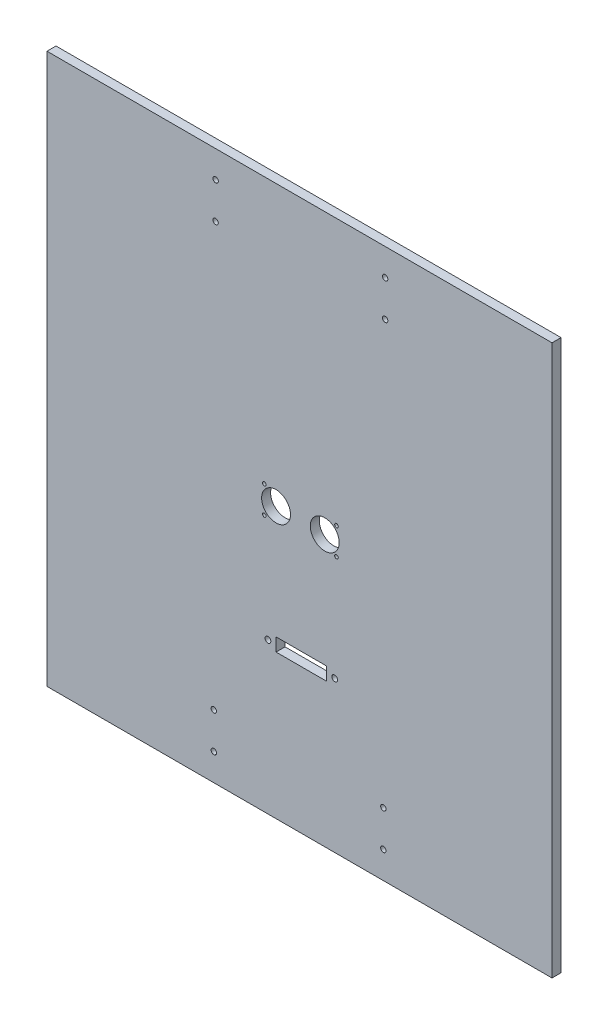
from build123d import *

# Parameters (mm, degrees)
ESQUISSE1_W             = 280
ESQUISSE1_H             = 305
BOSS_EXTRU_1_DEPTH      = 5
ESQUISSE2_R             = 1.5
ENL_V_MAT_EXTRU_1_DEPTH = 415.065212255
ESQUISSE3_R             = 1.5
ENL_V_MAT_EXTRU_2_DEPTH = 415.065212255
ESQUISSE4_R             = 1.6
ESQUISSE4_W             = 28
ESQUISSE4_H             = 7.3
ENL_V_MAT_EXTRU_3_DEPTH = 415.065212255
ESQUISSE5_R             = 8
ESQUISSE5_R_2           = 1
ENL_V_MAT_EXTRU_4_DEPTH = 415.065212255


with BuildPart() as part:
    # Esquisse1 → Boss.-Extru.1 (new body)
    with BuildSketch(Plane.XY):
        with Locations((140, 152.5)):
            Rectangle(ESQUISSE1_W, ESQUISSE1_H)
    extrude(amount=BOSS_EXTRU_1_DEPTH)

    # Esquisse2 → Enlèv. mat.-Extru.1 (cut, through all)
    with BuildSketch(Plane.XY.offset(5)):
        with Locations((92.5, 35)):
            Circle(ESQUISSE2_R)
        with Locations((92.5, 15)):
            Circle(ESQUISSE2_R)
        with Locations((186.5, 35)):
            Circle(ESQUISSE2_R)
        with Locations((186.5, 15)):
            Circle(ESQUISSE2_R)
    extrude(amount=-ENL_V_MAT_EXTRU_1_DEPTH, mode=Mode.SUBTRACT)

    # Esquisse3 → Enlèv. mat.-Extru.2 (cut, through all)
    with BuildSketch(Plane.XY.offset(5)):
        with Locations((187.5, 270)):
            Circle(ESQUISSE3_R)
        with Locations((187.5, 290)):
            Circle(ESQUISSE3_R)
        with Locations((93.5, 270)):
            Circle(ESQUISSE3_R)
        with Locations((93.5, 290)):
            Circle(ESQUISSE3_R)
    extrude(amount=-ENL_V_MAT_EXTRU_2_DEPTH, mode=Mode.SUBTRACT)

    # Esquisse4 → Enlèv. mat.-Extru.3 (cut, through all)
    with BuildSketch(Plane(origin=(0, 0, 0), x_dir=(-1, 0, 0), z_dir=(0, 0, -1))):
        with Locations((-159.5, 83.65)):
            Circle(ESQUISSE4_R)
        with Locations((-122.5, 83.65)):
            Circle(ESQUISSE4_R)
        with Locations((-141, 83.65)):
            Rectangle(ESQUISSE4_W, ESQUISSE4_H)
    extrude(amount=-ENL_V_MAT_EXTRU_3_DEPTH, mode=Mode.SUBTRACT)

    # Esquisse5 → Enlèv. mat.-Extru.4 (cut, through all)
    with BuildSketch(Plane(origin=(0, 0, 0), x_dir=(-1, 0, 0), z_dir=(0, 0, -1))):
        with Locations((-154, 150)):
            Circle(ESQUISSE5_R)
        with Locations((-127, 150)):
            Circle(ESQUISSE5_R)
        with Locations((-160.502638889, 157.491467645)):
            Circle(ESQUISSE5_R_2)
        with Locations((-120.502645848, 157.515062528)):
            Circle(ESQUISSE5_R_2)
        with Locations((-120.498818515, 142.502017666)):
            Circle(ESQUISSE5_R_2)
        with Locations((-160.498818515, 142.491467645)):
            Circle(ESQUISSE5_R_2)
    extrude(amount=-ENL_V_MAT_EXTRU_4_DEPTH, mode=Mode.SUBTRACT)


solid = part.part
